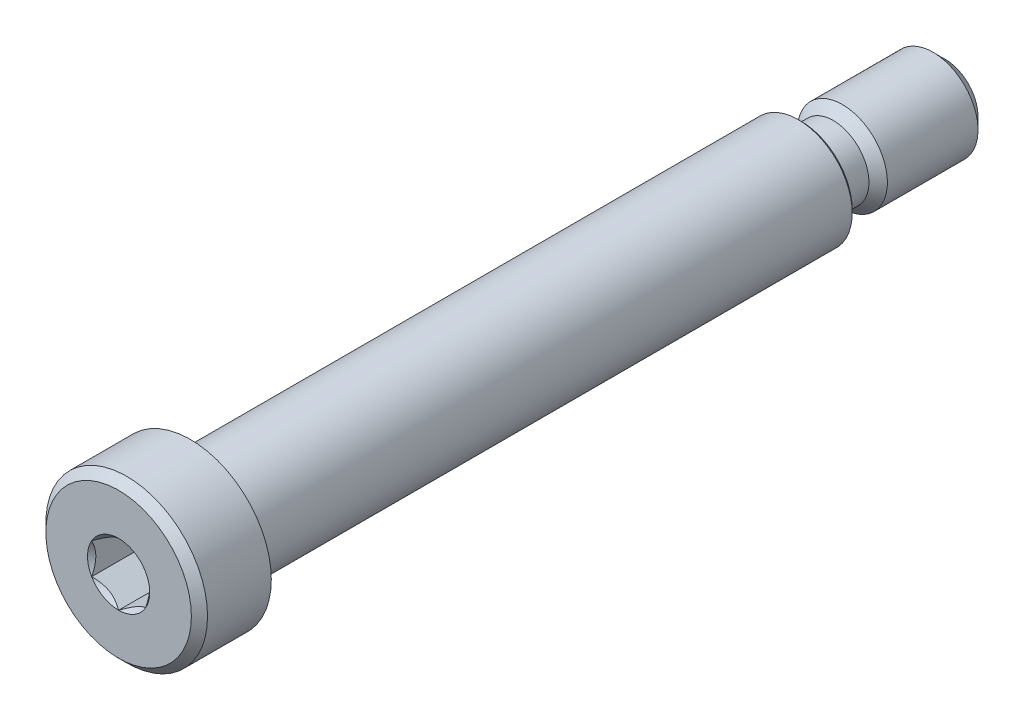
from build123d import *

# Parameters (mm, degrees)
CUT_EXTRUDE1_DEPTH = 4.7625


with BuildPart() as part:
    # Sketch4 → Revolve1 (revolve)
    with BuildSketch(Plane(origin=(0, 0, 0), x_dir=(0, 0, -1), z_dir=(1, 0, 0))):
        Polygon((-30.1625, 7.14375), (-35.798125, 7.14375), (-36.5125, 6.429375), (-36.5125, 0), (23.8125, 0), (23.8125, 4.500033333), (23.550033333, 4.7625), (-30.1625, 4.7625), align=None)
    revolve(axis=Axis((0, 0, 36.5125), (0, 0, -1)))

    # Sketch5 → Cut-Extrude1 (cut)
    with BuildSketch(Plane.XY.offset(36.5125)):
        Polygon((2.38125, 1.374815329), (0, 2.749630657), (-2.38125, 1.374815329), (-2.38125, -1.374815329), (0, -2.749630657), (2.38125, -1.374815329), align=None)
    extrude(amount=-CUT_EXTRUDE1_DEPTH, mode=Mode.SUBTRACT)

    # Cut-Extrude4 cone 1 section (through the dimple's axis) → Cut-Extrude4 (revolve, cut)
    with BuildSketch(Plane(origin=(0, 0, 36.5125), x_dir=(0, -1, 0), z_dir=(1, 0, 0))):
        Polygon((0, 0), (2.749630657, 0), (0, 2.749630657), align=None)
    revolve(axis=Axis((0, 0, 36.5125), (0, 0, -1)), mode=Mode.SUBTRACT)

    # Sketch7 → Revolve2 (revolve)
    with BuildSketch(Plane(origin=(0, 0, 0), x_dir=(0, 0, -1), z_dir=(1, 0, 0))):
        Polygon((23.8125, 3.9751), (35.454166667, 3.9751), (36.5125, 2.916766667), (36.5125, 0), (23.8125, 0), align=None)
    revolve(axis=Axis((0, 0, -36.5125), (0, 0, 1)))

    # Sketch10 → Cut-Revolve1 (revolve, cut)
    with BuildSketch(Plane(origin=(0, 0, 0), x_dir=(0, 0, -1), z_dir=(1, 0, 0))):
        with BuildLine():
            Line((24.6253, 3.1623), (26.6319, 3.1623))
            Line((26.6319, 3.1623), (28.2321, 4.7625))
            Line((28.2321, 4.7625), (23.8125, 4.7625))
            Line((23.8125, 4.7625), (23.8125, 3.9751))
            ThreePointArc((23.8125, 3.9751), (24.050563608, 3.400363608), (24.6253, 3.1623))
        make_face()
    revolve(axis=Axis((0, 0, -36.5125), (0, 0, 1)), mode=Mode.SUBTRACT)


solid = part.part
